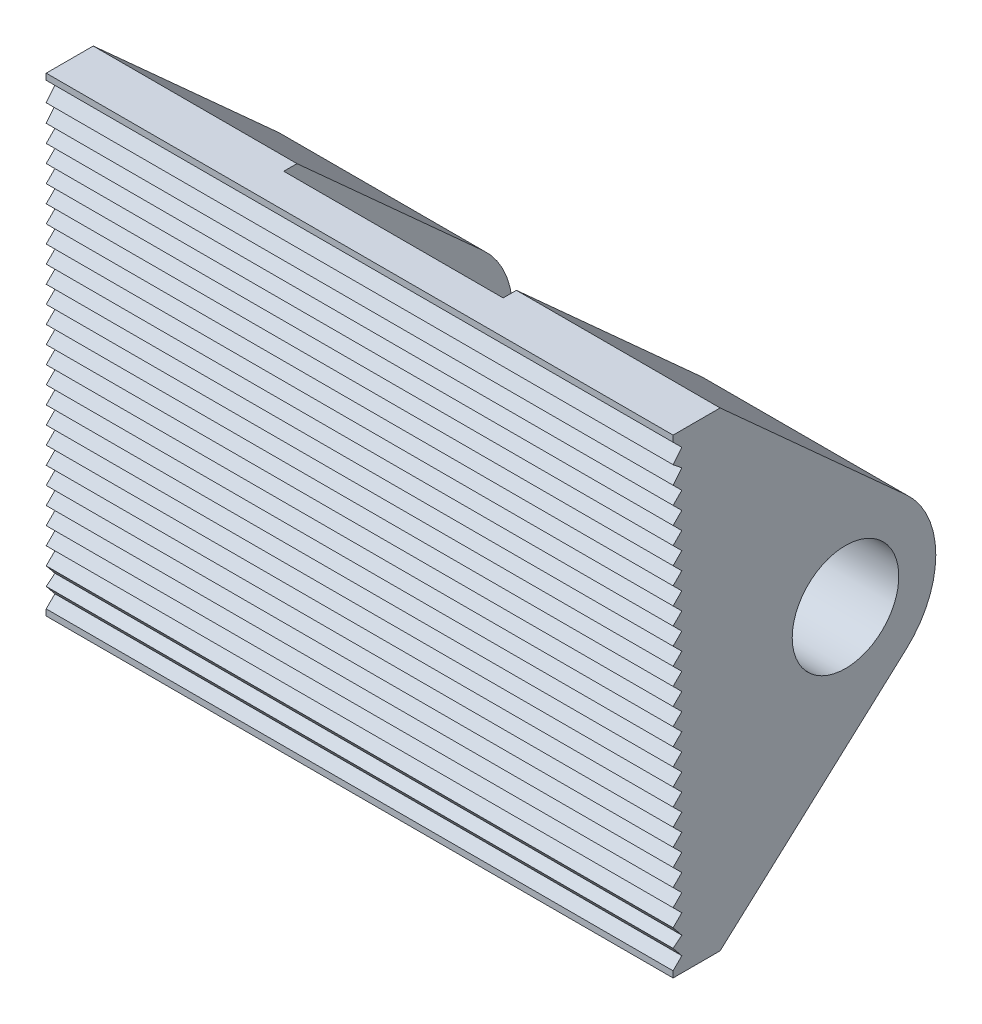
from build123d import *

# Parameters (mm, degrees)
ESQUISSE2_W             = 20
ESQUISSE2_H             = 15
BOSS_EXTRU_1_DEPTH      = 1.5
ESQUISSE3_R             = 1.7
BOSS_EXTRU_2_DEPTH      = 20
ENL_V_MAT_EXTRU_2_DEPTH = 3.5
ENL_V_MAT_EXTRU_4_DEPTH = 21


with BuildPart() as part:
    # Esquisse2 → Boss.-Extru.1 (new body)
    with BuildSketch(Plane.XY):
        Rectangle(ESQUISSE2_W, ESQUISSE2_H)
    extrude(amount=BOSS_EXTRU_1_DEPTH)

    # Esquisse3 → Boss.-Extru.2 (add)
    with BuildSketch(Plane.ZY.offset(10)):
        with BuildLine():
            Line((-5.931892952, 2.136705913), (0, 7.5))
            Line((0, 7.5), (0, -7.5))
            Line((0, -7.5), (-5.931892952, -2.136705913))
            ThreePointArc((-5.931892952, -2.136705913), (-6.880576771, 0), (-5.931892952, 2.136705913))
        make_face()
        with Locations((-4, 0)):
            Circle(ESQUISSE3_R, mode=Mode.SUBTRACT)
    extrude(amount=-BOSS_EXTRU_2_DEPTH)

    # Esquisse5 → Enlèv. mat.-Extru.2 (cut, symmetric)
    with BuildSketch(Plane.ZY):
        with BuildLine():
            Line((0.421634759, 7.5), (0.421634759, -7.5))
            Line((0.421634759, -7.5), (0, -7.5))
            Line((0, -7.5), (-5.931892952, -2.136705913))
            ThreePointArc((-5.931892952, -2.136705913), (-6.880576771, 0), (-5.931892952, 2.136705913))
            Line((-5.931892952, 2.136705913), (0, 7.5))
            Line((0, 7.5), (0.421634759, 7.5))
        make_face()
    extrude(amount=ENL_V_MAT_EXTRU_2_DEPTH, both=True, mode=Mode.SUBTRACT)

    # Esquisse4 → Enlèv. mat.-Extru.4 (cut)
    with BuildSketch(Plane.ZY.offset(10)):
        Polygon((1.222110979, 7.02363184), (1.5, 6.681425034), (1.5, 7.301520861), align=None)
        Polygon((1.222110979, 6.455765268), (1.5, 6.113558462), (1.5, 6.681425034), align=None)
        Polygon((1.222110979, 5.835669441), (1.5, 5.55778042), (1.5, 6.113558462), align=None)
        Polygon((1.222110979, 5.279891399), (1.5, 5.002002378), (1.5, 5.55778042), align=None)
        Polygon((1.222110979, 4.724113357), (1.5, 4.446224336), (1.5, 5.002002378), align=None)
        Polygon((1.222110979, 4.168335315), (1.5, 3.890446294), (1.5, 4.446224336), align=None)
        Polygon((1.222110979, 3.612557273), (1.5, 3.334668252), (1.5, 3.890446294), align=None)
        Polygon((1.222110979, 3.056779231), (1.5, 2.77889021), (1.5, 3.334668252), align=None)
        Polygon((1.222110979, 2.501001189), (1.5, 2.223112168), (1.5, 2.77889021), align=None)
        Polygon((1.222110979, 1.945223147), (1.5, 1.667334126), (1.5, 2.223112168), align=None)
        Polygon((1.222110979, 1.389445105), (1.5, 1.111556084), (1.5, 1.667334126), align=None)
        Polygon((1.222110979, 0.833667063), (1.5, 0.555778042), (1.5, 1.111556084), align=None)
        Polygon((1.222110979, 0.277889021), (1.5, 0), (1.5, 0.555778042), align=None)
        Polygon((1.5, -0.555778042), (1.5, 0), (1.222110979, -0.277889021), align=None)
        Polygon((1.5, -1.111556084), (1.5, -0.555778042), (1.222110979, -0.833667063), align=None)
        Polygon((1.5, -1.667334126), (1.5, -1.111556084), (1.222110979, -1.389445105), align=None)
        Polygon((1.5, -2.223112168), (1.5, -1.667334126), (1.222110979, -1.945223147), align=None)
        Polygon((1.5, -2.77889021), (1.5, -2.223112168), (1.222110979, -2.501001189), align=None)
        Polygon((1.5, -3.334668252), (1.5, -2.77889021), (1.222110979, -3.056779231), align=None)
        Polygon((1.5, -3.890446294), (1.5, -3.334668252), (1.222110979, -3.612557273), align=None)
        Polygon((1.5, -4.446224336), (1.5, -3.890446294), (1.222110979, -4.168335315), align=None)
        Polygon((1.5, -5.002002378), (1.5, -4.446224336), (1.222110979, -4.724113357), align=None)
        Polygon((1.5, -5.55778042), (1.5, -5.002002378), (1.222110979, -5.279891399), align=None)
        Polygon((1.5, -6.113558462), (1.5, -5.55778042), (1.222110979, -5.835669441), align=None)
        Polygon((1.5, -6.681425034), (1.5, -6.113558462), (1.222110979, -6.455765268), align=None)
        Polygon((1.5, -7.301520861), (1.5, -6.681425034), (1.222110979, -7.02363184), align=None)
    extrude(amount=-ENL_V_MAT_EXTRU_4_DEPTH, mode=Mode.SUBTRACT)


solid = part.part
